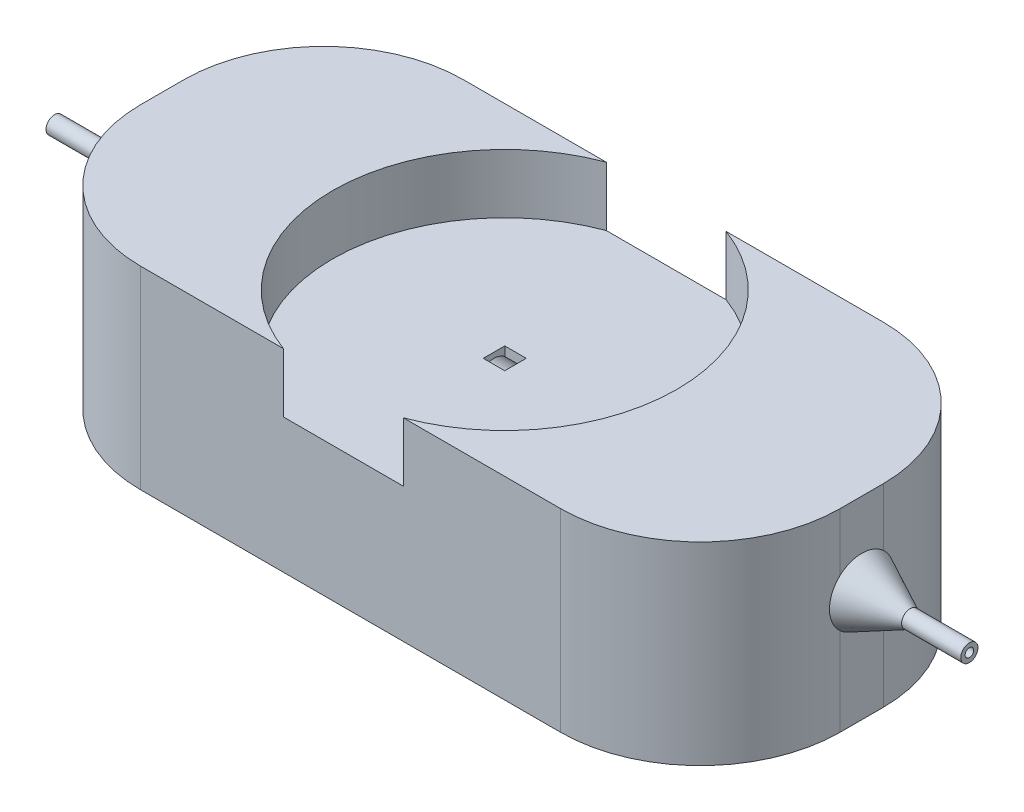
from build123d import *

# Parameters (mm, degrees)
SKETCH1_W           = 65
SKETCH1_H           = 30
BOSS_EXTRUDE1_DEPTH = 58
FILLET1_R           = 13
SKETCH15_W          = 83.696095513
SKETCH15_H          = 31.69844841
CUT_EXTRUDE7_DEPTH  = 50
SKETCH18_R          = 16
CUT_EXTRUDE10_DEPTH = 5.5
CUT_EXTRUDE12_REACH = 90.397
SKETCH3_R           = 1.6
SKETCH21_W          = 2
SKETCH21_H          = 2
CUT_EXTRUDE13_DEPTH = 8


with BuildPart() as part:
    # Sketch1 → Boss-Extrude1 (new body)
    with BuildSketch(Plane(origin=(0, 0, 0), x_dir=(1, 0, 0), z_dir=(0, 1, 0))):
        with Locations((7.5, 0)):
            Rectangle(SKETCH1_W, SKETCH1_H)
    extrude(amount=BOSS_EXTRUDE1_DEPTH)

    # Fillet1
    fillet1_edges = [part.edges().sort_by_distance(p)[0] for p in [
        (40, 29, 15),
        (-25, 29, 15),
        (-25, 29, -15),
        (40, 29, -15),
    ]]
    fillet(fillet1_edges, radius=FILLET1_R)

    # Sketch15 → Cut-Extrude7 (cut)
    with BuildSketch(Plane(origin=(0, -10, 0), x_dir=(-1, 0, 0), z_dir=(0, -1, 0))):
        with Locations((-0.057440767, 0.030479277)):
            Rectangle(SKETCH15_W, SKETCH15_H)
    extrude(amount=-CUT_EXTRUDE7_DEPTH, mode=Mode.SUBTRACT)

    # Sketch18 → Cut-Extrude10 (cut)
    with BuildSketch(Plane(origin=(0, 58, 0), x_dir=(1, 0, 0), z_dir=(0, 1, 0))):
        with Locations((6.828508286, 0)):
            Circle(SKETCH18_R)
    extrude(amount=-CUT_EXTRUDE10_DEPTH, mode=Mode.SUBTRACT)

    # Sketch3 → Cut-Extrude12 (cut, up to next)
    with BuildSketch(Plane.ZY.offset(25), mode=Mode.PRIVATE) as cut_extrude12_sk1:
        with Locations((0, 50.4)):
            Circle(SKETCH3_R)
    cut_extrude12_tool1 = extrude(cut_extrude12_sk1.sketch, amount=-CUT_EXTRUDE12_REACH, mode=Mode.PRIVATE) & part.part
    add(cut_extrude12_tool1.solids().sort_by_distance((-25, 50.4, 0))[0], mode=Mode.SUBTRACT)

    # Sketch21 → Cut-Extrude13 (cut)
    with BuildSketch(Plane(origin=(0, 52.5, 0), x_dir=(1, 0, 0), z_dir=(0, 1, 0))):
        with Locations((6.828508286, 0)):
            Rectangle(SKETCH21_W, SKETCH21_H)
    extrude(amount=-CUT_EXTRUDE13_DEPTH, mode=Mode.SUBTRACT)

    # Sketch24 → Revolve1 (revolve)
    with BuildSketch(Plane.XY, mode=Mode.PRIVATE) as revolve1_sk:
        Polygon((-25, 50.8), (-35, 50.8), (-35, 51.2), (-29.5, 51.2), (-25, 53.4), align=None)
    revolve(revolve1_sk.sketch.rotate(Axis((-25, 50.4, 0), (-1, 0, 0)), 90), axis=Axis((-25, 50.4, 0), (-1, 0, 0)))

    # Sketch25 → Revolve2 (revolve)
    with BuildSketch(Plane.XY, mode=Mode.PRIVATE) as revolve2_sk:
        Polygon((40, 50.79856611), (40, 53.39856611), (44.5, 51.19856611), (50, 51.19856611), (50, 50.79856611), align=None)
    revolve(revolve2_sk.sketch.rotate(Axis((50.482197819, 50.39856611, 0), (-1, 0, 0)), 90), axis=Axis((50.482197819, 50.39856611, 0), (-1, 0, 0)))


solid = part.part
